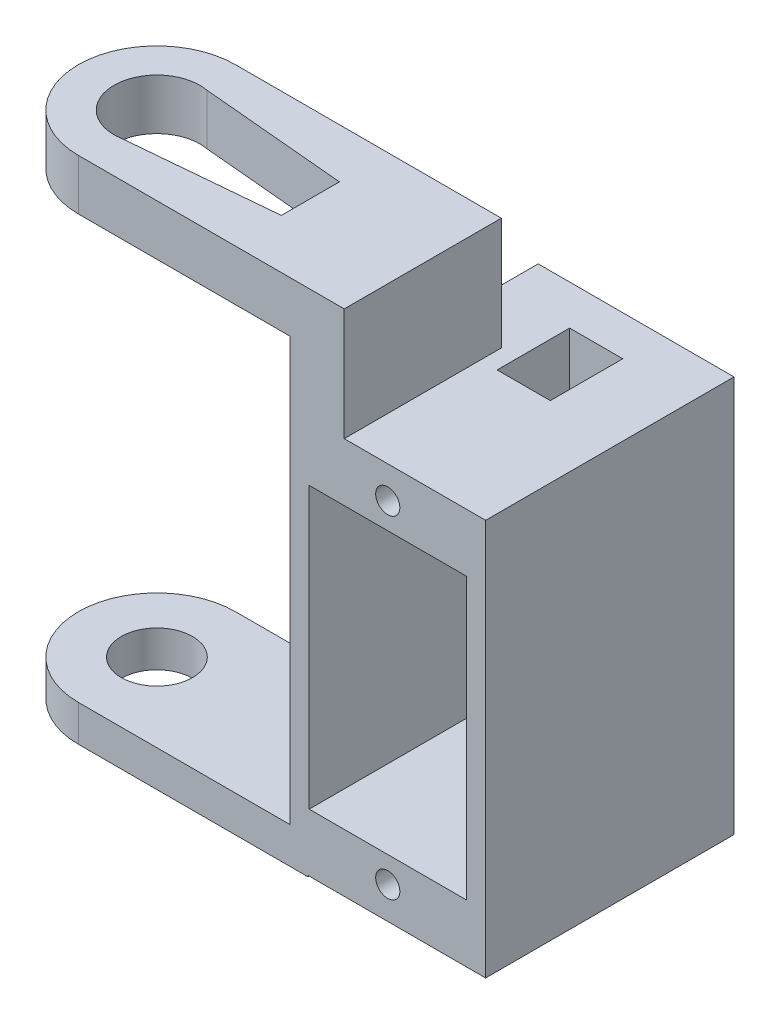
from build123d import *

# Parameters (mm, degrees)
BOSS_EXTRUDE1_START = -3.775
SKETCH1_W           = 16.2
SKETCH1_H           = 32.8
BOSS_EXTRUDE1_DEPTH = 10.275
BOSS_EXTRUDE2_START = -65.25
SKETCH2_W           = 13
SKETCH2_H           = 11.7
BOSS_EXTRUDE2_DEPTH = 2.25
BOSS_EXTRUDE3_START = 82.6
SKETCH3_R           = 6.5
BOSS_EXTRUDE3_DEPTH = 2.1
BOSS_EXTRUDE4_START = 82.6
SKETCH4_W           = 19
SKETCH4_H           = 13
BOSS_EXTRUDE4_DEPTH = 2.1
CUT_EXTRUDE1_START  = 82.6
SKETCH5_R           = 3.55
CUT_EXTRUDE1_DEPTH  = 2.1
CUT_EXTRUDE2_START  = 82.6
CUT_EXTRUDE2_DEPTH  = 2.1
BOSS_EXTRUDE5_START = 44
SKETCH7_R           = 6.5
BOSS_EXTRUDE5_DEPTH = 1.5
BOSS_EXTRUDE6_START = 44
SKETCH8_W           = 19
SKETCH8_H           = 13
BOSS_EXTRUDE6_DEPTH = 1.5
CUT_EXTRUDE3_START  = 44
SKETCH9_R           = 2.95
CUT_EXTRUDE3_DEPTH  = 1.5
CUT_EXTRUDE4_START  = -2.125
SKETCH10_W          = 13
SKETCH10_H          = 23.2
CUT_EXTRUDE4_DEPTH  = 8.625
CUT_EXTRUDE5_START  = 3.5
SKETCH11_R          = 1
CUT_EXTRUDE5_DEPTH  = 3
CUT_EXTRUDE6_START  = 3.5
SKETCH12_R          = 1
CUT_EXTRUDE6_DEPTH  = 3
CUT_EXTRUDE7_START  = -12.75
SKETCH13_R          = 3.15
CUT_EXTRUDE7_DEPTH  = 1.3
CUT_EXTRUDE8_START  = 73
SKETCH14_W          = 4.4
SKETCH14_H          = 6
CUT_EXTRUDE8_DEPTH  = 2.4


with BuildPart() as part:
    # Sketch1 → Boss-Extrude1 (new, symmetric)
    with BuildSketch(Plane.XY.offset(BOSS_EXTRUDE1_START)):
        with Locations((-59.4, 59)):
            Rectangle(SKETCH1_W, SKETCH1_H)
    extrude(amount=BOSS_EXTRUDE1_DEPTH, both=True)

    # Sketch2 → Boss-Extrude2 (add, symmetric)
    with BuildSketch(Plane(origin=(0, 0, 0), x_dir=(0, 0, -1), z_dir=(1, 0, 0)).offset(BOSS_EXTRUDE2_START)):
        with Locations((0, 78.85)):
            Rectangle(SKETCH2_W, SKETCH2_H)
    extrude(amount=BOSS_EXTRUDE2_DEPTH, both=True)



with BuildPart() as body_2:
    # Sketch3 → Boss-Extrude3 (new, symmetric)
    with BuildSketch(Plane(origin=(0, 0, 0), x_dir=(1, 0, 0), z_dir=(0, 1, 0)).offset(BOSS_EXTRUDE3_START)):
        with Locations(Location((-85, 0, 0), (0, 0, 270))):
            Circle(SKETCH3_R)
    extrude(amount=BOSS_EXTRUDE3_DEPTH, both=True)


with BuildPart() as part_1:
    add(part.part)

    add(body_2.part)  # Boss-Extrude4 merges body 2
    # Sketch4 → Boss-Extrude4 (add, symmetric)
    with BuildSketch(Plane(origin=(0, 0, 0), x_dir=(1, 0, 0), z_dir=(0, 1, 0)).offset(BOSS_EXTRUDE4_START)):
        with Locations((-75.5, 0)):
            Rectangle(SKETCH4_W, SKETCH4_H)
    extrude(amount=BOSS_EXTRUDE4_DEPTH, both=True)

    # Sketch5 → Cut-Extrude1 (cut, symmetric)
    with BuildSketch(Plane(origin=(0, 0, 0), x_dir=(1, 0, 0), z_dir=(0, 1, 0)).offset(CUT_EXTRUDE1_START)):
        with Locations(Location((-85, 0, 0), (0, 0, 270))):
            Circle(SKETCH5_R)
    extrude(amount=CUT_EXTRUDE1_DEPTH, both=True, mode=Mode.SUBTRACT)

    # Sketch6 → Cut-Extrude2 (cut, symmetric)
    with BuildSketch(Plane(origin=(0, 0, 0), x_dir=(1, 0, 0), z_dir=(0, 1, 0)).offset(CUT_EXTRUDE2_START)):
        Polygon((-85, -3.55), (-72.3, -2.403281405), (-72.3, 2.403281405), (-85, 3.55), align=None)
    extrude(amount=CUT_EXTRUDE2_DEPTH, both=True, mode=Mode.SUBTRACT)



with BuildPart() as body_2_2:
    # Sketch7 → Boss-Extrude5 (new, symmetric)
    with BuildSketch(Plane(origin=(0, 0, 0), x_dir=(1, 0, 0), z_dir=(0, 1, 0)).offset(BOSS_EXTRUDE5_START)):
        with Locations(Location((-85, 0, 0), (0, 0, 270))):
            Circle(SKETCH7_R)
    extrude(amount=BOSS_EXTRUDE5_DEPTH, both=True)


with BuildPart() as part_2:
    add(part_1.part)

    add(body_2_2.part)  # Boss-Extrude6 merges body 2 2
    # Sketch8 → Boss-Extrude6 (add, symmetric)
    with BuildSketch(Plane(origin=(0, 0, 0), x_dir=(1, 0, 0), z_dir=(0, 1, 0)).offset(BOSS_EXTRUDE6_START)):
        with Locations((-75.5, 0)):
            Rectangle(SKETCH8_W, SKETCH8_H)
    extrude(amount=BOSS_EXTRUDE6_DEPTH, both=True)

    # Sketch9 → Cut-Extrude3 (cut, symmetric)
    with BuildSketch(Plane(origin=(0, 0, 0), x_dir=(1, 0, 0), z_dir=(0, 1, 0)).offset(CUT_EXTRUDE3_START)):
        with Locations(Location((-85, 0, 0), (0, 0, 270))):
            Circle(SKETCH9_R)
    extrude(amount=CUT_EXTRUDE3_DEPTH, both=True, mode=Mode.SUBTRACT)

    # Sketch10 → Cut-Extrude4 (cut, symmetric)
    with BuildSketch(Plane.XY.offset(CUT_EXTRUDE4_START)):
        with Locations((-59.4, 59)):
            Rectangle(SKETCH10_W, SKETCH10_H)
    extrude(amount=CUT_EXTRUDE4_DEPTH, both=True, mode=Mode.SUBTRACT)

    # Sketch11 → Cut-Extrude5 (cut, symmetric)
    with BuildSketch(Plane.XY.offset(CUT_EXTRUDE5_START)):
        with Locations((-59.4, 45.25)):
            Circle(SKETCH11_R)
    extrude(amount=CUT_EXTRUDE5_DEPTH, both=True, mode=Mode.SUBTRACT)

    # Sketch12 → Cut-Extrude6 (cut, symmetric)
    with BuildSketch(Plane.XY.offset(CUT_EXTRUDE6_START)):
        with Locations((-59.4, 72.75)):
            Circle(SKETCH12_R)
    extrude(amount=CUT_EXTRUDE6_DEPTH, both=True, mode=Mode.SUBTRACT)

    # Sketch13 → Cut-Extrude7 (cut, symmetric)
    with BuildSketch(Plane.XY.offset(CUT_EXTRUDE7_START)):
        with Locations((-59.4, 64.5)):
            Circle(SKETCH13_R)
    extrude(amount=CUT_EXTRUDE7_DEPTH, both=True, mode=Mode.SUBTRACT)

    # Sketch14 → Cut-Extrude8 (cut, symmetric)
    with BuildSketch(Plane(origin=(0, 0, 0), x_dir=(1, 0, 0), z_dir=(0, 1, 0)).offset(CUT_EXTRUDE8_START)):
        with Locations((-59.4, 7.75)):
            Rectangle(SKETCH14_W, SKETCH14_H)
    extrude(amount=CUT_EXTRUDE8_DEPTH, both=True, mode=Mode.SUBTRACT)


solid = part_2.part
